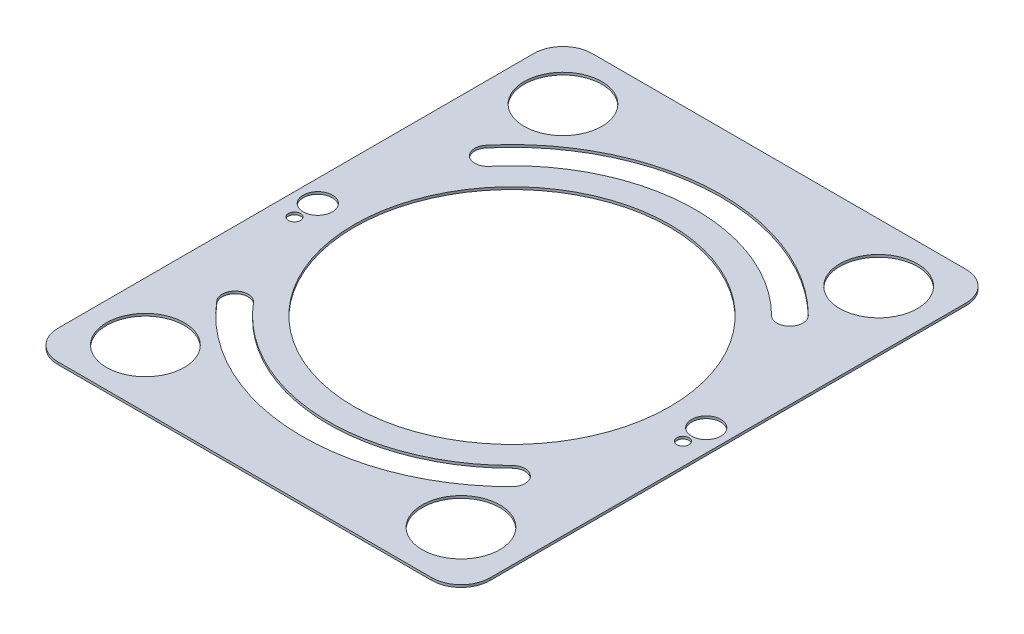
from build123d import *

# Parameters (mm, degrees)
SKETCH1_R           = 12.7
SKETCH1_R_2         = 51.59375
SKETCH1_R_3         = 4.7625
SKETCH1_R_4         = 1.984375
BOSS_EXTRUDE1_DEPTH = 0.79375


with BuildPart() as part:
    # Sketch1 → Boss-Extrude1 (new body)
    with BuildSketch(Plane(origin=(0, 0, 0), x_dir=(1, 0, 0), z_dir=(0, 1, 0))):
        with BuildLine():
            Line((-61.11875, 87.3125), (61.11875, 87.3125))
            ThreePointArc((61.11875, 87.3125), (67.853942091, 84.522692091), (70.64375, 77.7875))
            Line((70.64375, 77.7875), (70.64375, -77.7875))
            ThreePointArc((70.64375, -77.7875), (67.853942091, -84.522692091), (61.11875, -87.3125))
            Line((61.11875, -87.3125), (-61.11875, -87.3125))
            ThreePointArc((-61.11875, -87.3125), (-67.853942091, -84.522692091), (-70.64375, -77.7875))
            Line((-70.64375, -77.7875), (-70.64375, 77.7875))
            ThreePointArc((-70.64375, 77.7875), (-67.853942091, 84.522692091), (-61.11875, 87.3125))
        make_face()
        with Locations(Location((-51.59375, 68.2625, 0), (0, 0, 270))):
            Circle(SKETCH1_R, mode=Mode.SUBTRACT)
        with Locations(Location((51.59375, 68.2625, 0), (0, 0, 270))):
            Circle(SKETCH1_R, mode=Mode.SUBTRACT)
        with Locations(Location((-51.59375, -68.2625, 0), (0, 0, 270))):
            Circle(SKETCH1_R, mode=Mode.SUBTRACT)
        with Locations(Location((51.59375, -68.2625, 0), (0, 0, 270))):
            Circle(SKETCH1_R, mode=Mode.SUBTRACT)
        with Locations(Location((0, 0, 0), (0, 0, 270))):
            Circle(SKETCH1_R_2, mode=Mode.SUBTRACT)
        with Locations(Location((-63.5, 0, 0), (0, 0, 270))):
            Circle(SKETCH1_R_3, mode=Mode.SUBTRACT)
        with Locations(Location((63.5, 0, 0), (0, 0, 270))):
            Circle(SKETCH1_R_3, mode=Mode.SUBTRACT)
        with Locations(Location((-63.5, -7.62, 0), (0, 0, 270))):
            Circle(SKETCH1_R_4, mode=Mode.SUBTRACT)
        with Locations(Location((63.5, -7.62, 0), (0, 0, 270))):
            Circle(SKETCH1_R_4, mode=Mode.SUBTRACT)
        with BuildLine():
            ThreePointArc((-52.47407269, 44.03097504), (-51.950230865, 38.043435583), (-45.962691407, 38.567277408))
            ThreePointArc((-45.962691407, 38.567277408), (-2.617164655, 59.942925664), (42.426429781, 42.426429781))
            ThreePointArc((42.426429781, 42.426429781), (48.436840667, 42.426429781), (48.436840667, 48.436840667))
            ThreePointArc((48.436840667, 48.436840667), (-2.987929648, 68.434840133), (-52.47407269, 44.03097504))
        make_face(mode=Mode.SUBTRACT)
        with BuildLine():
            ThreePointArc((42.426429781, -42.426429781), (-2.617164655, -59.942925664), (-45.962691407, -38.567277408))
            ThreePointArc((-45.962691407, -38.567277408), (-51.950230865, -38.043435583), (-52.47407269, -44.03097504))
            ThreePointArc((-52.47407269, -44.03097504), (-2.987929648, -68.434840133), (48.436840667, -48.436840667))
            ThreePointArc((48.436840667, -48.436840667), (48.436840667, -42.426429781), (42.426429781, -42.426429781))
        make_face(mode=Mode.SUBTRACT)
    extrude(amount=BOSS_EXTRUDE1_DEPTH)


solid = part.part
